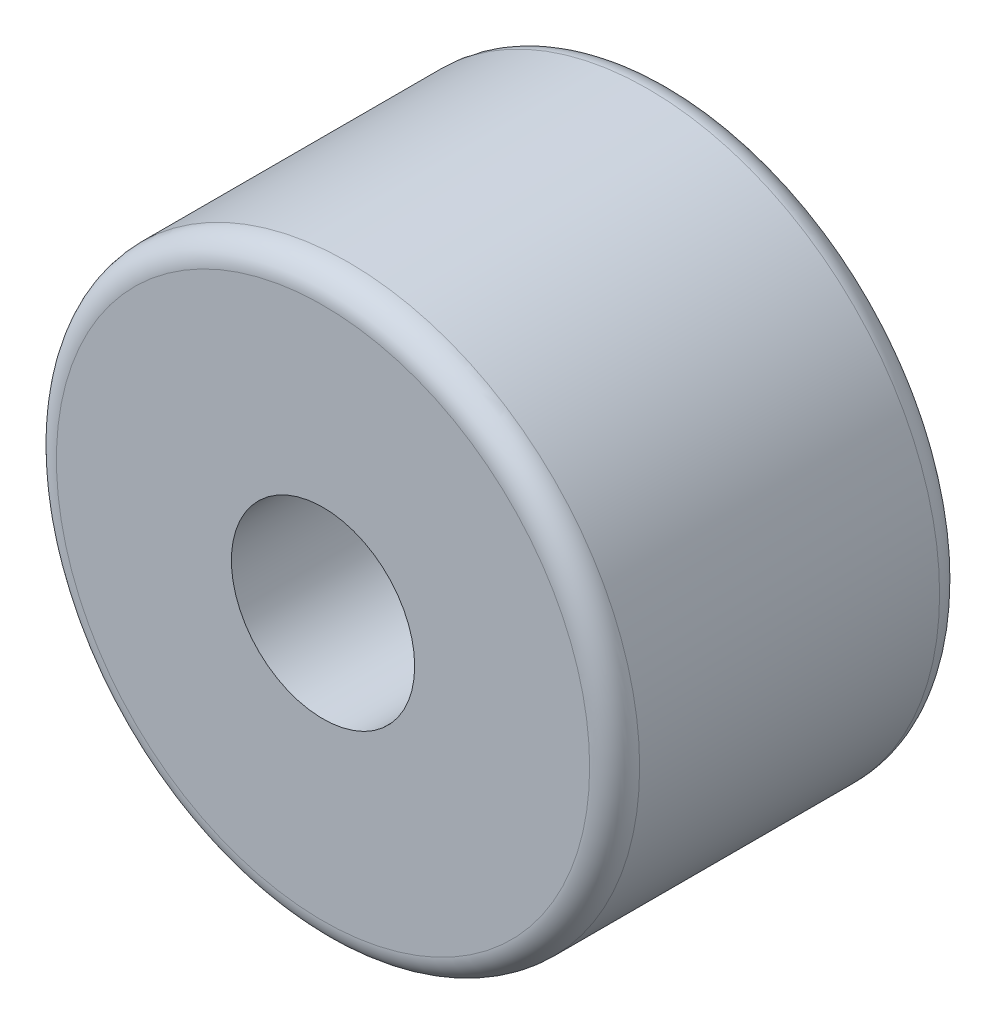
from build123d import *

# Parameters (mm, degrees)
SKETCH1_R           = 35
BOSS_EXTRUDE1_DEPTH = 42
FILLET1_R           = 3
SKETCH2_R           = 11
CUT_EXTRUDE1_DEPTH  = 65.915329522


with BuildPart() as part:
    # Sketch1 → Boss-Extrude1 (new body)
    with BuildSketch(Plane.XY):
        with Locations(Location((0, 0, 0), (0, 0, 180))):
            Circle(SKETCH1_R)
    extrude(amount=BOSS_EXTRUDE1_DEPTH)

    # Fillet1
    fillet1_edges = [part.edges().sort_by_distance(p)[0] for p in [
        (35, 0, 0),
        (35, 0, 42),
    ]]
    fillet(fillet1_edges, radius=FILLET1_R)

    # Sketch2 → Cut-Extrude1 (cut, through all)
    with BuildSketch(Plane.XY.offset(42)):
        Circle(SKETCH2_R)
    extrude(amount=-CUT_EXTRUDE1_DEPTH, mode=Mode.SUBTRACT)


solid = part.part
